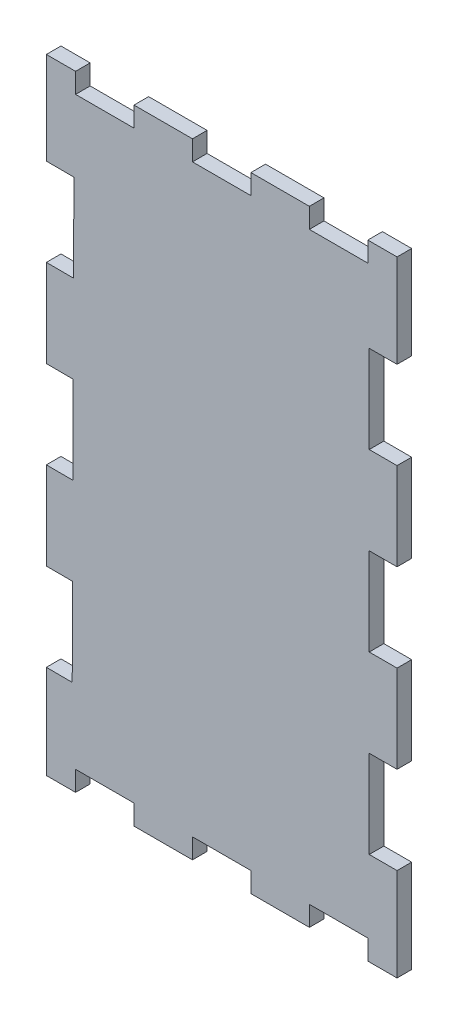
from build123d import *

# Parameters (mm, degrees)
SKETCH1_W           = 76.2
SKETCH1_H           = 135.6868
BOSS_EXTRUDE1_DEPTH = 3.175
SKETCH2_W           = 12.7
SKETCH2_H           = 8.6868
CUT_EXTRUDE1_DEPTH  = 78.874370293
SKETCH3_W           = 12.0904
SKETCH3_H           = 19.05
CUT_EXTRUDE2_DEPTH  = 78.874370293


with BuildPart() as part:
    # Sketch1 → Boss-Extrude1 (new body)
    with BuildSketch(Plane.XY):
        Rectangle(SKETCH1_W, SKETCH1_H)
    extrude(amount=BOSS_EXTRUDE1_DEPTH)

    # Sketch2 → Cut-Extrude1 (cut, through all)
    with BuildSketch(Plane.XY.offset(3.175)):
        with Locations((0, 67.8434)):
            Rectangle(SKETCH2_W, SKETCH2_H)
        with Locations((-25.4, 67.8434)):
            Rectangle(SKETCH2_W, SKETCH2_H)
        with Locations((25.4, 67.8434)):
            Rectangle(SKETCH2_W, SKETCH2_H)
        with Locations((25.4, -67.8434)):
            Rectangle(SKETCH2_W, SKETCH2_H)
        with Locations((-25.4, -67.8434)):
            Rectangle(SKETCH2_W, SKETCH2_H)
        with Locations((0, -67.8434)):
            Rectangle(SKETCH2_W, SKETCH2_H)
    extrude(amount=-CUT_EXTRUDE1_DEPTH, mode=Mode.SUBTRACT)

    # Sketch3 → Cut-Extrude2 (cut, through all)
    with BuildSketch(Plane.XY.offset(3.175)):
        with Locations((38.1, 0)):
            Rectangle(SKETCH3_W, SKETCH3_H)
        with Locations((38.1, 38.1)):
            Rectangle(SKETCH3_W, SKETCH3_H)
        with Locations((38.1, -38.1)):
            Rectangle(SKETCH3_W, SKETCH3_H)
        Polygon((-44.277990322, 28.743505915), (-32.187678137, 28.697425322), (-32.115072161, 47.747286959), (-44.205384346, 47.793367552), align=None)
        Polygon((-32.332890089, -9.402297951), (-32.260284113, 9.647563686), (-44.350596298, 9.693644279), (-44.423202274, -9.356217358), align=None)
        Polygon((-32.405496065, -28.452159587), (-32.478102041, -47.502021224), (-44.568414227, -47.455940631), (-44.495808251, -28.406078995), align=None)
    extrude(amount=-CUT_EXTRUDE2_DEPTH, mode=Mode.SUBTRACT)


solid = part.part
